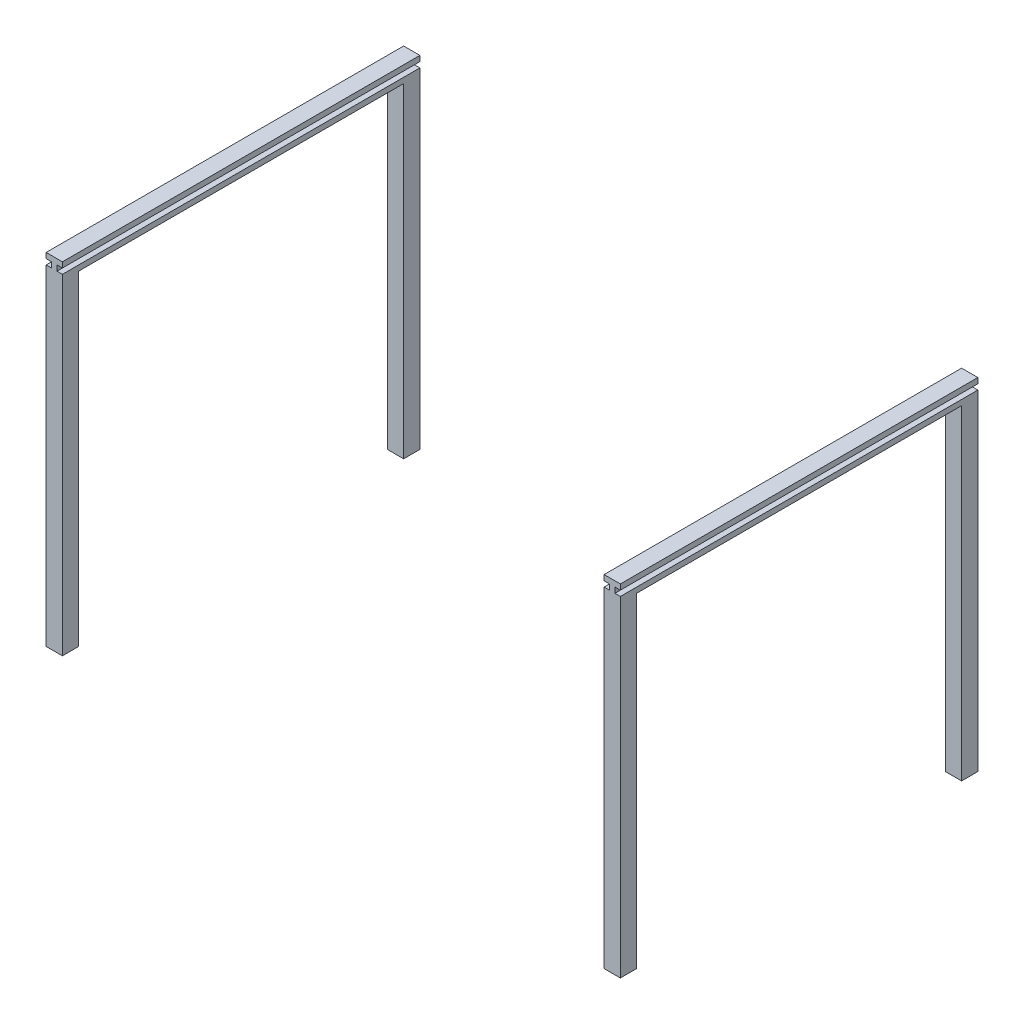
from build123d import *

# Parameters (mm, degrees)
SKETCH1_W             = 150
SKETCH1_H             = 150
BOSS_EXTRUDE1_DEPTH   = 3000
BOSS_EXTRUDE1_2_DEPTH = 3000
BOSS_EXTRUDE1_3_DEPTH = 3000
BOSS_EXTRUDE1_4_DEPTH = 3000
BOSS_EXTRUDE2_DEPTH   = 3300


with BuildPart() as part:
    # Sketch1 → Boss-Extrude1 (new body)
    with BuildSketch(Plane(origin=(0, 0, 0), x_dir=(1, 0, 0), z_dir=(0, 1, 0))):
        with Locations((-2575, 1575)):
            Rectangle(SKETCH1_W, SKETCH1_H)
    extrude(amount=BOSS_EXTRUDE1_DEPTH)



with BuildPart() as body_2:
    # Sketch1 → Boss-Extrude1 2 (new body)
    with BuildSketch(Plane(origin=(0, 0, 0), x_dir=(1, 0, 0), z_dir=(0, 1, 0))):
        with Locations((-2575, -1575)):
            Rectangle(SKETCH1_W, SKETCH1_H)
    extrude(amount=BOSS_EXTRUDE1_2_DEPTH)


with BuildPart() as body_3:
    # Sketch1 → Boss-Extrude1 3 (new body)
    with BuildSketch(Plane(origin=(0, 0, 0), x_dir=(1, 0, 0), z_dir=(0, 1, 0))):
        with Locations((2575, 1575)):
            Rectangle(SKETCH1_W, SKETCH1_H)
    extrude(amount=BOSS_EXTRUDE1_3_DEPTH)


with BuildPart() as body_4:
    # Sketch1 → Boss-Extrude1 4 (new body)
    with BuildSketch(Plane(origin=(0, 0, 0), x_dir=(1, 0, 0), z_dir=(0, 1, 0))):
        with Locations((2575, -1575)):
            Rectangle(SKETCH1_W, SKETCH1_H)
    extrude(amount=BOSS_EXTRUDE1_4_DEPTH)


with BuildPart() as part_1:
    add(part.part)

    add(body_2.part)  # Boss-Extrude2 merges body 2

    add(body_3.part)  # Boss-Extrude2 merges body 3

    add(body_4.part)  # Boss-Extrude2 merges body 4
    # Sketch2 → Boss-Extrude2 (add)
    with BuildSketch(Plane.XY.offset(1650)):
        Polygon((-2500, 3000), (-2650, 3000), (-2650, 3050), (-2600, 3050), (-2600, 3100), (-2650, 3100), (-2650, 3150), (-2500, 3150), (-2500, 3100), (-2550, 3100), (-2550, 3050), (-2500, 3050), align=None)
        Polygon((2500, 3150), (2650, 3150), (2650, 3100), (2600, 3100), (2600, 3050), (2650, 3050), (2650, 3000), (2500, 3000), (2500, 3050), (2550, 3050), (2550, 3100), (2500, 3100), align=None)
    extrude(amount=-BOSS_EXTRUDE2_DEPTH)


solid = part_1.part
